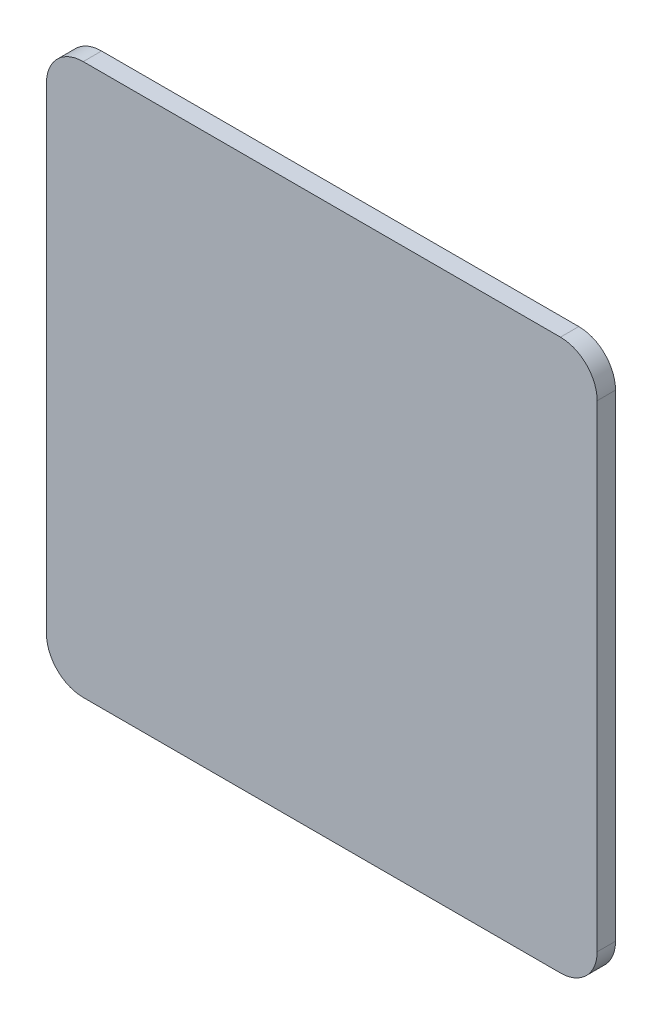
from build123d import *

# Parameters (mm, degrees)
SKETCH1_W           = 30
SKETCH1_H           = 30
BOSS_EXTRUDE1_DEPTH = 1
FILLET1_R           = 2


with BuildPart() as part:
    # Sketch1 → Boss-Extrude1 (new body)
    with BuildSketch(Plane.XY):
        with Locations((15, 15)):
            Rectangle(SKETCH1_W, SKETCH1_H)
    extrude(amount=BOSS_EXTRUDE1_DEPTH)

    # Fillet1
    fillet1_edges = [part.edges().sort_by_distance(p)[0] for p in [
        (0, 30, 0.5),
        (30, 30, 0.5),
        (30, 0, 0.5),
        (0, 0, 0.5),
    ]]
    fillet(fillet1_edges, radius=FILLET1_R)


solid = part.part
